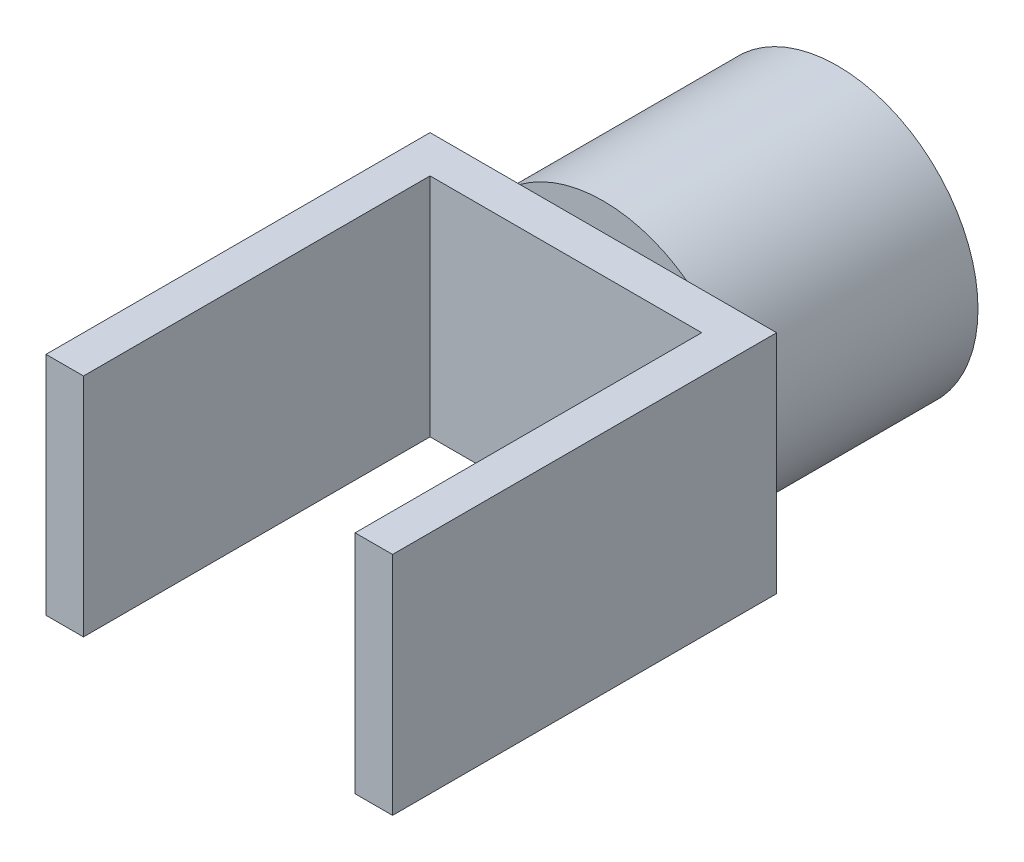
from build123d import *

# Parameters (mm, degrees)
ESQUISSE1_R        = 150
BOSS_EXTRU_1_DEPTH = 250
ESQUISSE2_R        = 70
BOSS_EXTRU_2_DEPTH = 10
ESQUISSE3_W        = 370
ESQUISSE3_H        = 241.309251742
BOSS_EXTRU_3_DEPTH = 40
ESQUISSE4_W        = 40
ESQUISSE4_H        = 241.309251742
BOSS_EXTRU_4_DEPTH = 370
ESQUISSE5_R        = 70
BOSS_EXTRU_5_DEPTH = 10


with BuildPart() as part:
    # Esquisse1 → Boss.-Extru.1 (new body)
    with BuildSketch(Plane.XY):
        Circle(ESQUISSE1_R)
    extrude(amount=BOSS_EXTRU_1_DEPTH)

    # Esquisse2 → Boss.-Extru.2 (add)
    with BuildSketch(Plane(origin=(0, 0, 0), x_dir=(-1, 0, 0), z_dir=(0, 0, -1))):
        Circle(ESQUISSE2_R)
    extrude(amount=BOSS_EXTRU_2_DEPTH)

    # Esquisse3 → Boss.-Extru.3 (add)
    with BuildSketch(Plane.XY.offset(250)):
        Rectangle(ESQUISSE3_W, ESQUISSE3_H)
    extrude(amount=BOSS_EXTRU_3_DEPTH)

    # Esquisse4 → Boss.-Extru.4 (add)
    with BuildSketch(Plane.XY.offset(290)):
        with Locations((-165, 0)):
            Rectangle(ESQUISSE4_W, ESQUISSE4_H)
        with Locations((165, 0)):
            Rectangle(ESQUISSE4_W, ESQUISSE4_H)
    extrude(amount=BOSS_EXTRU_4_DEPTH)

    # Esquisse5 → Boss.-Extru.5 (add)
    with BuildSketch(Plane.ZY.offset(-145)):
        with Locations(Location((560, -0.654625871, 0), (0, 0, 180))):
            Circle(ESQUISSE5_R)
    extrude(amount=BOSS_EXTRU_5_DEPTH)


solid = part.part
